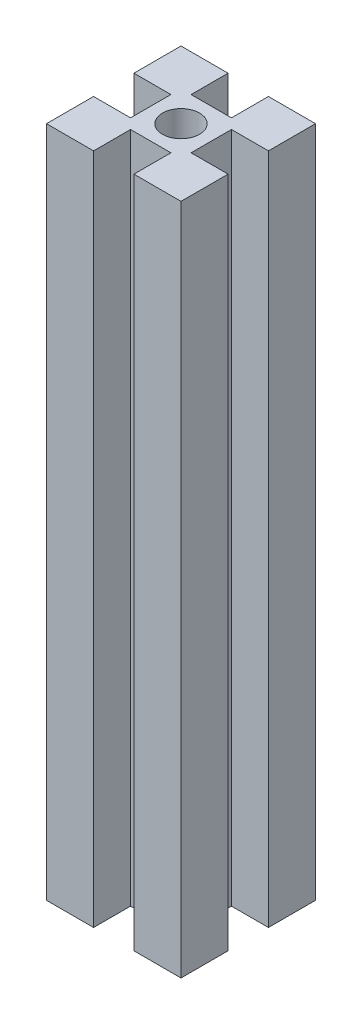
from build123d import *

# Parameters (mm, degrees)
SKETCH1_W    = 20
SKETCH1_H    = 20
BODY_DEPTH   = 100
SKETCH2_R    = 2.75
SKETCH2_W    = 6
SKETCH2_H    = 5.5
SKETCH2_W_2  = 5.5
SKETCH2_H_2  = 6
PROFIL_DEPTH = 101.995049384


with BuildPart() as part:
    # Sketch1 → Body (new body)
    with BuildSketch(Plane(origin=(0, 0, 0), x_dir=(1, 0, 0), z_dir=(0, 1, 0))):
        Rectangle(SKETCH1_W, SKETCH1_H)
    extrude(amount=BODY_DEPTH)

    # Sketch2 → Profil (cut, through all)
    with BuildSketch(Plane(origin=(0, 100, 0), x_dir=(1, 0, 0), z_dir=(0, 1, 0))):
        with Locations(Location((0, 0, 0), (0, 0, 270))):
            Circle(SKETCH2_R)
        with Locations((0, 7.25)):
            Rectangle(SKETCH2_W, SKETCH2_H)
        with Locations((7.25, 0)):
            Rectangle(SKETCH2_W_2, SKETCH2_H_2)
        with Locations((0, -7.25)):
            Rectangle(SKETCH2_W, SKETCH2_H)
        with Locations((-7.25, 0)):
            Rectangle(SKETCH2_W_2, SKETCH2_H_2)
    extrude(amount=-PROFIL_DEPTH, mode=Mode.SUBTRACT)


solid = part.part
